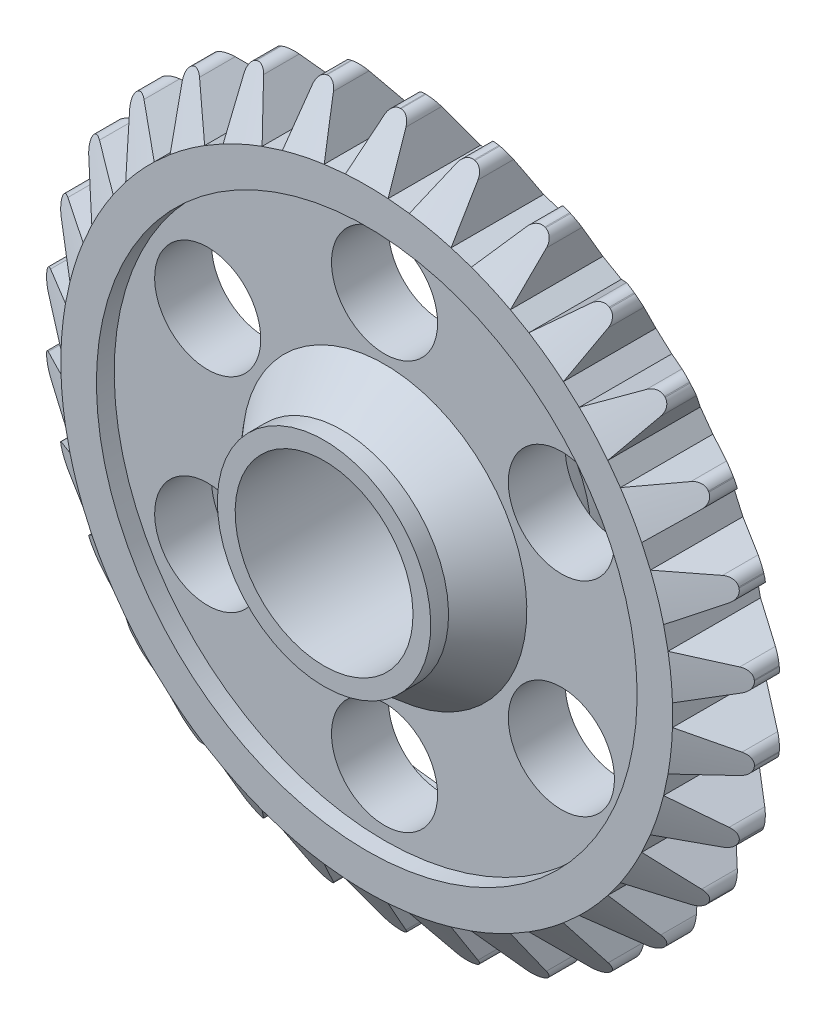
from build123d import *

# Parameters (mm, degrees)
SKETCH_4_W                           = 24
SKETCH_4_H                           = 6
CUT_REVOLVE_1_ANGLE                  = 180
SKETCH_6_W                           = 50
SKETCH_6_H                           = 25
SKETCH_10_W                          = 25
SKETCH_10_H                          = 15
REVOLVE_3_ANGLE                      = 180
SKETCH_13_W                          = 20
SKETCH_13_H                          = 26
CUT_REVOLVE_4_ANGLE                  = 20
PATTERN_CIRCULAR_30_COUNT            = 30
PATTERN_CIRCULAR_30_COPY_1_SKETCH_W  = 20
PATTERN_CIRCULAR_30_COPY_1_SKETCH_H  = 26
PATTERN_CIRCULAR_30_COPY_1_ANGLE     = 20
PATTERN_CIRCULAR_30_COPY_2_SKETCH_W  = 20
PATTERN_CIRCULAR_30_COPY_2_SKETCH_H  = 26
PATTERN_CIRCULAR_30_COPY_2_ANGLE     = 20
PATTERN_CIRCULAR_30_COPY_3_SKETCH_W  = 20
PATTERN_CIRCULAR_30_COPY_3_SKETCH_H  = 26
PATTERN_CIRCULAR_30_COPY_3_ANGLE     = 20
PATTERN_CIRCULAR_30_COPY_4_SKETCH_W  = 20
PATTERN_CIRCULAR_30_COPY_4_SKETCH_H  = 26
PATTERN_CIRCULAR_30_COPY_4_ANGLE     = 20
PATTERN_CIRCULAR_30_COPY_5_SKETCH_W  = 20
PATTERN_CIRCULAR_30_COPY_5_SKETCH_H  = 26
PATTERN_CIRCULAR_30_COPY_5_ANGLE     = 20
PATTERN_CIRCULAR_30_COPY_6_SKETCH_W  = 20
PATTERN_CIRCULAR_30_COPY_6_SKETCH_H  = 26
PATTERN_CIRCULAR_30_COPY_6_ANGLE     = 20
PATTERN_CIRCULAR_30_COPY_7_SKETCH_W  = 20
PATTERN_CIRCULAR_30_COPY_7_SKETCH_H  = 26
PATTERN_CIRCULAR_30_COPY_7_ANGLE     = 20
PATTERN_CIRCULAR_30_COPY_8_SKETCH_W  = 20
PATTERN_CIRCULAR_30_COPY_8_SKETCH_H  = 26
PATTERN_CIRCULAR_30_COPY_8_ANGLE     = 20
PATTERN_CIRCULAR_30_COPY_9_SKETCH_W  = 20
PATTERN_CIRCULAR_30_COPY_9_SKETCH_H  = 26
PATTERN_CIRCULAR_30_COPY_9_ANGLE     = 20
PATTERN_CIRCULAR_30_COPY_10_SKETCH_W = 20
PATTERN_CIRCULAR_30_COPY_10_SKETCH_H = 26
PATTERN_CIRCULAR_30_COPY_10_ANGLE    = 20
PATTERN_CIRCULAR_30_COPY_11_SKETCH_W = 20
PATTERN_CIRCULAR_30_COPY_11_SKETCH_H = 26
PATTERN_CIRCULAR_30_COPY_11_ANGLE    = 20
PATTERN_CIRCULAR_30_COPY_12_SKETCH_W = 20
PATTERN_CIRCULAR_30_COPY_12_SKETCH_H = 26
PATTERN_CIRCULAR_30_COPY_12_ANGLE    = 20
PATTERN_CIRCULAR_30_COPY_13_SKETCH_W = 20
PATTERN_CIRCULAR_30_COPY_13_SKETCH_H = 26
PATTERN_CIRCULAR_30_COPY_13_ANGLE    = 20
PATTERN_CIRCULAR_30_COPY_14_SKETCH_W = 20
PATTERN_CIRCULAR_30_COPY_14_SKETCH_H = 26
PATTERN_CIRCULAR_30_COPY_14_ANGLE    = 20
PATTERN_CIRCULAR_30_COPY_15_SKETCH_W = 20
PATTERN_CIRCULAR_30_COPY_15_SKETCH_H = 26
PATTERN_CIRCULAR_30_COPY_15_ANGLE    = 20
PATTERN_CIRCULAR_30_COPY_16_SKETCH_W = 20
PATTERN_CIRCULAR_30_COPY_16_SKETCH_H = 26
PATTERN_CIRCULAR_30_COPY_16_ANGLE    = 20
PATTERN_CIRCULAR_30_COPY_17_SKETCH_W = 20
PATTERN_CIRCULAR_30_COPY_17_SKETCH_H = 26
PATTERN_CIRCULAR_30_COPY_17_ANGLE    = 20
PATTERN_CIRCULAR_30_COPY_18_SKETCH_W = 20
PATTERN_CIRCULAR_30_COPY_18_SKETCH_H = 26
PATTERN_CIRCULAR_30_COPY_18_ANGLE    = 20
PATTERN_CIRCULAR_30_COPY_19_SKETCH_W = 20
PATTERN_CIRCULAR_30_COPY_19_SKETCH_H = 26
PATTERN_CIRCULAR_30_COPY_19_ANGLE    = 20
PATTERN_CIRCULAR_30_COPY_20_SKETCH_W = 20
PATTERN_CIRCULAR_30_COPY_20_SKETCH_H = 26
PATTERN_CIRCULAR_30_COPY_20_ANGLE    = 20
PATTERN_CIRCULAR_30_COPY_21_SKETCH_W = 20
PATTERN_CIRCULAR_30_COPY_21_SKETCH_H = 26
PATTERN_CIRCULAR_30_COPY_21_ANGLE    = 20
PATTERN_CIRCULAR_30_COPY_22_SKETCH_W = 20
PATTERN_CIRCULAR_30_COPY_22_SKETCH_H = 26
PATTERN_CIRCULAR_30_COPY_22_ANGLE    = 20
PATTERN_CIRCULAR_30_COPY_23_SKETCH_W = 20
PATTERN_CIRCULAR_30_COPY_23_SKETCH_H = 26
PATTERN_CIRCULAR_30_COPY_23_ANGLE    = 20
PATTERN_CIRCULAR_30_COPY_24_SKETCH_W = 20
PATTERN_CIRCULAR_30_COPY_24_SKETCH_H = 26
PATTERN_CIRCULAR_30_COPY_24_ANGLE    = 20
PATTERN_CIRCULAR_30_COPY_25_SKETCH_W = 20
PATTERN_CIRCULAR_30_COPY_25_SKETCH_H = 26
PATTERN_CIRCULAR_30_COPY_25_ANGLE    = 20
PATTERN_CIRCULAR_30_COPY_26_SKETCH_W = 20
PATTERN_CIRCULAR_30_COPY_26_SKETCH_H = 26
PATTERN_CIRCULAR_30_COPY_26_ANGLE    = 20
PATTERN_CIRCULAR_30_COPY_27_SKETCH_W = 20
PATTERN_CIRCULAR_30_COPY_27_SKETCH_H = 26
PATTERN_CIRCULAR_30_COPY_27_ANGLE    = 20
PATTERN_CIRCULAR_30_COPY_28_SKETCH_W = 20
PATTERN_CIRCULAR_30_COPY_28_SKETCH_H = 26
PATTERN_CIRCULAR_30_COPY_28_ANGLE    = 20
PATTERN_CIRCULAR_30_COPY_29_SKETCH_W = 20
PATTERN_CIRCULAR_30_COPY_29_SKETCH_H = 26
PATTERN_CIRCULAR_30_COPY_29_ANGLE    = 20
FILLET_7_R                           = 3
SKETCH_15_W                          = 26
SKETCH_15_H                          = 14.918348738
PATTERN_CIRCULAR_31_COUNT            = 6


with BuildPart() as part:
    # Эскиз2 → Повернуть1 (revolve)
    with BuildSketch(Plane(origin=(0, 0, 0), x_dir=(0, 0, -1), z_dir=(1, 0, 0)), mode=Mode.PRIVATE) as revolve_1_sk:
        Polygon((-20, 0), (20, 0), (20, 25), (25, 25), (25, 30), (20, 30), (8, 40), (8, 76), (13, 76), (13, 86), (3.5, 100), (-3.5, 100), (-13, 86), (-13, 76), (-8, 76), (-8, 40), (-20, 30), (-25, 30), (-25, 25), (-20, 25), align=None)
    revolve(revolve_1_sk.sketch.rotate(Axis((0, 0, 20), (0, 0, -1)), 180), axis=Axis((0, 0, 20), (0, 0, -1)))

    # Эскиз4 → Вырез-Повернуть1 (revolve, symmetric, cut)
    with BuildSketch(Plane.XY) as cut_revolve_1_sk:
        with Locations((-97.947658491, 0)):
            Rectangle(SKETCH_4_W, SKETCH_4_H)
    cut_revolve_1 = revolve(axis=Axis((-85.947658491, 3, 0), (0, -1, 0)), revolution_arc=CUT_REVOLVE_1_ANGLE / 2, mode=Mode.SUBTRACT)
    cut_revolve_1 = cut_revolve_1 + revolve(cut_revolve_1_sk.sketch, axis=Axis((-85.947658491, 3, 0), (0, 1, 0)), revolution_arc=CUT_REVOLVE_1_ANGLE / 2, mode=Mode.SUBTRACT)

    # Эскиз6 → Вырез-Повернуть2 (revolve, cut)
    with BuildSketch(Plane(origin=(0, 0, 0), x_dir=(0, 0, -1), z_dir=(1, 0, 0)), mode=Mode.PRIVATE) as cut_revolve_2_sk:
        with Locations((0, 12.5)):
            Rectangle(SKETCH_6_W, SKETCH_6_H)
    revolve(cut_revolve_2_sk.sketch.rotate(Axis((0, 0, 25), (0, 0, -1)), 180), axis=Axis((0, 0, 25), (0, 0, -1)), mode=Mode.SUBTRACT)

    # Эскиз10 → Повернуть3 (revolve)
    with BuildSketch(Plane(origin=(0, 10, 0), x_dir=(-1, 0, 0), z_dir=(0, -1, 0))):
        with Locations((12.5, 0)):
            Rectangle(SKETCH_10_W, SKETCH_10_H)
    revolve(axis=Axis((0, 10, 7.5), (0, 0, -1)), revolution_arc=REVOLVE_3_ANGLE)

    # Эскиз13 → Вырез-Повернуть4 (revolve, cut)
    with BuildSketch(Plane(origin=(0, 3, 0), x_dir=(1, 0, 0), z_dir=(0, 1, 0))):
        with Locations((-95.947658491, 0)):
            Rectangle(SKETCH_13_W, SKETCH_13_H)
    cut_revolve_4 = revolve(axis=Axis((-85.947658491, 3, -13), (0, 0, -1)), revolution_arc=CUT_REVOLVE_4_ANGLE, mode=Mode.SUBTRACT)

    # Зеркальное отражение1: Вырез-Повернуть4 across plane
    add(cut_revolve_4.mirror(Plane.ZX), mode=Mode.SUBTRACT)

    # Круговой массив30: Вырез-Повернуть1, Вырез-Повернуть4 ×30 about axis
    pattern_circular_30_axis = Axis((0, 0, 0), (0, 0, 1))
    add([cut_revolve_1.rotate(pattern_circular_30_axis, i * 360 / PATTERN_CIRCULAR_30_COUNT) for i in range(1, PATTERN_CIRCULAR_30_COUNT)], mode=Mode.SUBTRACT)
    add([cut_revolve_4.rotate(pattern_circular_30_axis, i * 360 / PATTERN_CIRCULAR_30_COUNT) for i in range(1, PATTERN_CIRCULAR_30_COUNT)], mode=Mode.SUBTRACT)

    # Круговой массив30 copy 1 sketch → Круговой массив30 copy 1 (revolve, cut)
    with BuildSketch(Plane(origin=(0.623735072, -2.934442802, 0), x_dir=(0.9781476007338057, 0.20791169081775934, 0), z_dir=(0.20791169081775934, -0.9781476007338057, 0))):
        with Locations((-95.947658491, 0)):
            Rectangle(PATTERN_CIRCULAR_30_COPY_1_SKETCH_W, PATTERN_CIRCULAR_30_COPY_1_SKETCH_H)
    revolve(axis=Axis((-83.445760869, -20.803965801, -13), (0, 0, 1)), revolution_arc=PATTERN_CIRCULAR_30_COPY_1_ANGLE, mode=Mode.SUBTRACT)

    # Круговой массив30 copy 2 sketch → Круговой массив30 copy 2 (revolve, cut)
    with BuildSketch(Plane(origin=(1.220209929, -2.740636373, 0), x_dir=(0.9135454576426009, 0.4067366430758002, 0), z_dir=(0.4067366430758002, -0.9135454576426009, 0))):
        with Locations((-95.947658491, 0)):
            Rectangle(PATTERN_CIRCULAR_30_COPY_2_SKETCH_W, PATTERN_CIRCULAR_30_COPY_2_SKETCH_H)
    revolve(axis=Axis((-77.29688308, -37.698698468, -13), (0, 0, 1)), revolution_arc=PATTERN_CIRCULAR_30_COPY_2_ANGLE, mode=Mode.SUBTRACT)

    # Круговой массив30 copy 3 sketch → Круговой массив30 copy 3 (revolve, cut)
    with BuildSketch(Plane(origin=(1.763355757, -2.427050983, 0), x_dir=(0.8090169943749475, 0.5877852522924731, 0), z_dir=(0.5877852522924731, -0.8090169943749475, 0))):
        with Locations((-95.947658491, 0)):
            Rectangle(PATTERN_CIRCULAR_30_COPY_3_SKETCH_W, PATTERN_CIRCULAR_30_COPY_3_SKETCH_H)
    revolve(axis=Axis((-67.769760589, -52.945817113, -13), (0, 0, 1)), revolution_arc=PATTERN_CIRCULAR_30_COPY_3_ANGLE, mode=Mode.SUBTRACT)

    # Круговой массив30 copy 4 sketch → Круговой массив30 copy 4 (revolve, cut)
    with BuildSketch(Plane(origin=(2.229434476, -2.007391819, 0), x_dir=(0.6691306063588582, 0.7431448254773942, 0), z_dir=(0.7431448254773942, -0.6691306063588582, 0))):
        with Locations((-95.947658491, 0)):
            Rectangle(PATTERN_CIRCULAR_30_COPY_4_SKETCH_W, PATTERN_CIRCULAR_30_COPY_4_SKETCH_H)
    revolve(axis=Axis((-55.280774364, -65.878949488, -13), (0, 0, 1)), revolution_arc=PATTERN_CIRCULAR_30_COPY_4_ANGLE, mode=Mode.SUBTRACT)

    # Круговой массив30 copy 5 sketch → Круговой массив30 copy 5 (revolve, cut)
    with BuildSketch(Plane(origin=(2.598076211, -1.5, 0), x_dir=(0.5000000000000001, 0.8660254037844386, 0), z_dir=(0.8660254037844386, -0.5000000000000001, 0))):
        with Locations((-95.947658491, 0)):
            Rectangle(PATTERN_CIRCULAR_30_COPY_5_SKETCH_W, PATTERN_CIRCULAR_30_COPY_5_SKETCH_H)
    revolve(axis=Axis((-40.375753034, -75.932855649, -13), (0, 0, 1)), revolution_arc=PATTERN_CIRCULAR_30_COPY_5_ANGLE, mode=Mode.SUBTRACT)

    # Круговой массив30 copy 6 sketch → Круговой массив30 copy 6 (revolve, cut)
    with BuildSketch(Plane(origin=(2.853169549, -0.927050983, 0), x_dir=(0.30901699437494745, 0.9510565162951535, 0), z_dir=(0.9510565162951535, -0.30901699437494745, 0))):
        with Locations((-95.947658491, 0)):
            Rectangle(PATTERN_CIRCULAR_30_COPY_6_SKETCH_W, PATTERN_CIRCULAR_30_COPY_6_SKETCH_H)
    revolve(axis=Axis((-23.706117551, -82.668131651, -13), (0, 0, 1)), revolution_arc=PATTERN_CIRCULAR_30_COPY_6_ANGLE, mode=Mode.SUBTRACT)

    # Круговой массив30 copy 7 sketch → Круговой массив30 copy 7 (revolve, cut)
    with BuildSketch(Plane(origin=(2.983565686, -0.31358539, 0), x_dir=(0.10452846326765346, 0.9945218953682733, 0), z_dir=(0.9945218953682733, -0.10452846326765346, 0))):
        with Locations((-95.947658491, 0)):
            Rectangle(PATTERN_CIRCULAR_30_COPY_7_SKETCH_W, PATTERN_CIRCULAR_30_COPY_7_SKETCH_H)
    revolve(axis=Axis((-6.000410977, -85.790413614, -13), (0, 0, 1)), revolution_arc=PATTERN_CIRCULAR_30_COPY_7_ANGLE, mode=Mode.SUBTRACT)

    # Круговой массив30 copy 8 sketch → Круговой массив30 copy 8 (revolve, cut)
    with BuildSketch(Plane(origin=(2.983565686, 0.31358539, 0), x_dir=(-0.10452846326765355, 0.9945218953682733, 0), z_dir=(0.9945218953682733, 0.10452846326765355, 0))):
        with Locations((-95.947658491, 0)):
            Rectangle(PATTERN_CIRCULAR_30_COPY_8_SKETCH_W, PATTERN_CIRCULAR_30_COPY_8_SKETCH_H)
    revolve(axis=Axis((11.96754235, -85.163242835, -13), (0, 0, 1)), revolution_arc=PATTERN_CIRCULAR_30_COPY_8_ANGLE, mode=Mode.SUBTRACT)

    # Круговой массив30 copy 9 sketch → Круговой массив30 copy 9 (revolve, cut)
    with BuildSketch(Plane(origin=(2.853169549, 0.927050983, 0), x_dir=(-0.30901699437494734, 0.9510565162951536, 0), z_dir=(0.9510565162951536, 0.30901699437494734, 0))):
        with Locations((-95.947658491, 0)):
            Rectangle(PATTERN_CIRCULAR_30_COPY_9_SKETCH_W, PATTERN_CIRCULAR_30_COPY_9_SKETCH_H)
    revolve(axis=Axis((29.412456649, -80.814029685, -13), (0, 0, 1)), revolution_arc=PATTERN_CIRCULAR_30_COPY_9_ANGLE, mode=Mode.SUBTRACT)

    # Круговой массив30 copy 10 sketch → Круговой массив30 copy 10 (revolve, cut)
    with BuildSketch(Plane(origin=(2.598076211, 1.5, 0), x_dir=(-0.4999999999999998, 0.8660254037844387, 0), z_dir=(0.8660254037844387, 0.4999999999999998, 0))):
        with Locations((-95.947658491, 0)):
            Rectangle(PATTERN_CIRCULAR_30_COPY_10_SKETCH_W, PATTERN_CIRCULAR_30_COPY_10_SKETCH_H)
    revolve(axis=Axis((45.571905457, -72.932855649, -13), (0, 0, 1)), revolution_arc=PATTERN_CIRCULAR_30_COPY_10_ANGLE, mode=Mode.SUBTRACT)

    # Круговой массив30 copy 11 sketch → Круговой массив30 copy 11 (revolve, cut)
    with BuildSketch(Plane(origin=(2.229434476, 2.007391819, 0), x_dir=(-0.6691306063588582, 0.7431448254773942, 0), z_dir=(0.7431448254773942, 0.6691306063588582, 0))):
        with Locations((-95.947658491, 0)):
            Rectangle(PATTERN_CIRCULAR_30_COPY_11_SKETCH_W, PATTERN_CIRCULAR_30_COPY_11_SKETCH_H)
    revolve(axis=Axis((59.739643317, -61.86416585, -13), (0, 0, 1)), revolution_arc=PATTERN_CIRCULAR_30_COPY_11_ANGLE, mode=Mode.SUBTRACT)

    # Круговой массив30 copy 12 sketch → Круговой массив30 copy 12 (revolve, cut)
    with BuildSketch(Plane(origin=(1.763355757, 2.427050983, 0), x_dir=(-0.8090169943749473, 0.5877852522924732, 0), z_dir=(0.5877852522924732, 0.8090169943749473, 0))):
        with Locations((-95.947658491, 0)):
            Rectangle(PATTERN_CIRCULAR_30_COPY_12_SKETCH_W, PATTERN_CIRCULAR_30_COPY_12_SKETCH_H)
    revolve(axis=Axis((71.296472102, -48.091715147, -13), (0, 0, 1)), revolution_arc=PATTERN_CIRCULAR_30_COPY_12_ANGLE, mode=Mode.SUBTRACT)

    # Круговой массив30 copy 13 sketch → Круговой массив30 copy 13 (revolve, cut)
    with BuildSketch(Plane(origin=(1.220209929, 2.740636373, 0), x_dir=(-0.9135454576426008, 0.40673664307580043, 0), z_dir=(0.40673664307580043, 0.9135454576426008, 0))):
        with Locations((-95.947658491, 0)):
            Rectangle(PATTERN_CIRCULAR_30_COPY_13_SKETCH_W, PATTERN_CIRCULAR_30_COPY_13_SKETCH_H)
    revolve(axis=Axis((79.737302938, -32.217425722, -13), (0, 0, 1)), revolution_arc=PATTERN_CIRCULAR_30_COPY_13_ANGLE, mode=Mode.SUBTRACT)

    # Круговой массив30 copy 14 sketch → Круговой массив30 copy 14 (revolve, cut)
    with BuildSketch(Plane(origin=(0.623735072, 2.934442802, 0), x_dir=(-0.9781476007338057, 0.20791169081775931, 0), z_dir=(0.20791169081775931, 0.9781476007338057, 0))):
        with Locations((-95.947658491, 0)):
            Rectangle(PATTERN_CIRCULAR_30_COPY_14_SKETCH_W, PATTERN_CIRCULAR_30_COPY_14_SKETCH_H)
    revolve(axis=Axis((84.693231014, -14.935080196, -13), (0, 0, 1)), revolution_arc=PATTERN_CIRCULAR_30_COPY_14_ANGLE, mode=Mode.SUBTRACT)

    # Круговой массив30 copy 15 sketch → Круговой массив30 copy 15 (revolve, cut)
    with BuildSketch(Plane(origin=(0, 3, 0), x_dir=(-1, 0, 0), z_dir=(0, 1, 0))):
        with Locations((-95.947658491, 0)):
            Rectangle(PATTERN_CIRCULAR_30_COPY_15_SKETCH_W, PATTERN_CIRCULAR_30_COPY_15_SKETCH_H)
    revolve(axis=Axis((85.947658491, 3, -13), (0, 0, 1)), revolution_arc=PATTERN_CIRCULAR_30_COPY_15_ANGLE, mode=Mode.SUBTRACT)

    # Круговой массив30 copy 16 sketch → Круговой массив30 copy 16 (revolve, cut)
    with BuildSketch(Plane(origin=(-0.623735072, 2.934442802, 0), x_dir=(-0.9781476007338056, -0.2079116908177595, 0), z_dir=(-0.2079116908177595, 0.9781476007338056, 0))):
        with Locations((-95.947658491, 0)):
            Rectangle(PATTERN_CIRCULAR_30_COPY_16_SKETCH_W, PATTERN_CIRCULAR_30_COPY_16_SKETCH_H)
    revolve(axis=Axis((83.445760869, 20.803965801, -13), (0, 0, 1)), revolution_arc=PATTERN_CIRCULAR_30_COPY_16_ANGLE, mode=Mode.SUBTRACT)

    # Круговой массив30 copy 17 sketch → Круговой массив30 copy 17 (revolve, cut)
    with BuildSketch(Plane(origin=(-1.220209929, 2.740636373, 0), x_dir=(-0.9135454576426009, -0.4067366430758002, 0), z_dir=(-0.4067366430758002, 0.9135454576426009, 0))):
        with Locations((-95.947658491, 0)):
            Rectangle(PATTERN_CIRCULAR_30_COPY_17_SKETCH_W, PATTERN_CIRCULAR_30_COPY_17_SKETCH_H)
    revolve(axis=Axis((77.29688308, 37.698698468, -13), (0, 0, 1)), revolution_arc=PATTERN_CIRCULAR_30_COPY_17_ANGLE, mode=Mode.SUBTRACT)

    # Круговой массив30 copy 18 sketch → Круговой массив30 copy 18 (revolve, cut)
    with BuildSketch(Plane(origin=(-1.763355757, 2.427050983, 0), x_dir=(-0.8090169943749476, -0.587785252292473, 0), z_dir=(-0.587785252292473, 0.8090169943749476, 0))):
        with Locations((-95.947658491, 0)):
            Rectangle(PATTERN_CIRCULAR_30_COPY_18_SKETCH_W, PATTERN_CIRCULAR_30_COPY_18_SKETCH_H)
    revolve(axis=Axis((67.769760589, 52.945817113, -13), (0, 0, 1)), revolution_arc=PATTERN_CIRCULAR_30_COPY_18_ANGLE, mode=Mode.SUBTRACT)

    # Круговой массив30 copy 19 sketch → Круговой массив30 copy 19 (revolve, cut)
    with BuildSketch(Plane(origin=(-2.229434476, 2.007391819, 0), x_dir=(-0.6691306063588581, -0.7431448254773944, 0), z_dir=(-0.7431448254773944, 0.6691306063588581, 0))):
        with Locations((-95.947658491, 0)):
            Rectangle(PATTERN_CIRCULAR_30_COPY_19_SKETCH_W, PATTERN_CIRCULAR_30_COPY_19_SKETCH_H)
    revolve(axis=Axis((55.280774364, 65.878949488, -13), (0, 0, 1)), revolution_arc=PATTERN_CIRCULAR_30_COPY_19_ANGLE, mode=Mode.SUBTRACT)

    # Круговой массив30 copy 20 sketch → Круговой массив30 copy 20 (revolve, cut)
    with BuildSketch(Plane(origin=(-2.598076211, 1.5, 0), x_dir=(-0.5000000000000004, -0.8660254037844384, 0), z_dir=(-0.8660254037844384, 0.5000000000000004, 0))):
        with Locations((-95.947658491, 0)):
            Rectangle(PATTERN_CIRCULAR_30_COPY_20_SKETCH_W, PATTERN_CIRCULAR_30_COPY_20_SKETCH_H)
    revolve(axis=Axis((40.375753034, 75.932855649, -13), (0, 0, 1)), revolution_arc=PATTERN_CIRCULAR_30_COPY_20_ANGLE, mode=Mode.SUBTRACT)

    # Круговой массив30 copy 21 sketch → Круговой массив30 copy 21 (revolve, cut)
    with BuildSketch(Plane(origin=(-2.853169549, 0.927050983, 0), x_dir=(-0.30901699437494756, -0.9510565162951535, 0), z_dir=(-0.9510565162951535, 0.30901699437494756, 0))):
        with Locations((-95.947658491, 0)):
            Rectangle(PATTERN_CIRCULAR_30_COPY_21_SKETCH_W, PATTERN_CIRCULAR_30_COPY_21_SKETCH_H)
    revolve(axis=Axis((23.706117551, 82.668131651, -13), (0, 0, 1)), revolution_arc=PATTERN_CIRCULAR_30_COPY_21_ANGLE, mode=Mode.SUBTRACT)

    # Круговой массив30 copy 22 sketch → Круговой массив30 copy 22 (revolve, cut)
    with BuildSketch(Plane(origin=(-2.983565686, 0.31358539, 0), x_dir=(-0.10452846326765336, -0.9945218953682734, 0), z_dir=(-0.9945218953682734, 0.10452846326765336, 0))):
        with Locations((-95.947658491, 0)):
            Rectangle(PATTERN_CIRCULAR_30_COPY_22_SKETCH_W, PATTERN_CIRCULAR_30_COPY_22_SKETCH_H)
    revolve(axis=Axis((6.000410977, 85.790413614, -13), (0, 0, 1)), revolution_arc=PATTERN_CIRCULAR_30_COPY_22_ANGLE, mode=Mode.SUBTRACT)

    # Круговой массив30 copy 23 sketch → Круговой массив30 copy 23 (revolve, cut)
    with BuildSketch(Plane(origin=(-2.983565686, -0.31358539, 0), x_dir=(0.10452846326765299, -0.9945218953682734, 0), z_dir=(-0.9945218953682734, -0.10452846326765299, 0))):
        with Locations((-95.947658491, 0)):
            Rectangle(PATTERN_CIRCULAR_30_COPY_23_SKETCH_W, PATTERN_CIRCULAR_30_COPY_23_SKETCH_H)
    revolve(axis=Axis((-11.96754235, 85.163242835, -13), (0, 0, 1)), revolution_arc=PATTERN_CIRCULAR_30_COPY_23_ANGLE, mode=Mode.SUBTRACT)

    # Круговой массив30 copy 24 sketch → Круговой массив30 copy 24 (revolve, cut)
    with BuildSketch(Plane(origin=(-2.853169549, -0.927050983, 0), x_dir=(0.30901699437494723, -0.9510565162951536, 0), z_dir=(-0.9510565162951536, -0.30901699437494723, 0))):
        with Locations((-95.947658491, 0)):
            Rectangle(PATTERN_CIRCULAR_30_COPY_24_SKETCH_W, PATTERN_CIRCULAR_30_COPY_24_SKETCH_H)
    revolve(axis=Axis((-29.412456649, 80.814029685, -13), (0, 0, 1)), revolution_arc=PATTERN_CIRCULAR_30_COPY_24_ANGLE, mode=Mode.SUBTRACT)

    # Круговой массив30 copy 25 sketch → Круговой массив30 copy 25 (revolve, cut)
    with BuildSketch(Plane(origin=(-2.598076211, -1.5, 0), x_dir=(0.5000000000000001, -0.8660254037844386, 0), z_dir=(-0.8660254037844386, -0.5000000000000001, 0))):
        with Locations((-95.947658491, 0)):
            Rectangle(PATTERN_CIRCULAR_30_COPY_25_SKETCH_W, PATTERN_CIRCULAR_30_COPY_25_SKETCH_H)
    revolve(axis=Axis((-45.571905457, 72.932855649, -13), (0, 0, 1)), revolution_arc=PATTERN_CIRCULAR_30_COPY_25_ANGLE, mode=Mode.SUBTRACT)

    # Круговой массив30 copy 26 sketch → Круговой массив30 copy 26 (revolve, cut)
    with BuildSketch(Plane(origin=(-2.229434476, -2.007391819, 0), x_dir=(0.6691306063588578, -0.7431448254773946, 0), z_dir=(-0.7431448254773946, -0.6691306063588578, 0))):
        with Locations((-95.947658491, 0)):
            Rectangle(PATTERN_CIRCULAR_30_COPY_26_SKETCH_W, PATTERN_CIRCULAR_30_COPY_26_SKETCH_H)
    revolve(axis=Axis((-59.739643317, 61.86416585, -13), (0, 0, 1)), revolution_arc=PATTERN_CIRCULAR_30_COPY_26_ANGLE, mode=Mode.SUBTRACT)

    # Круговой массив30 copy 27 sketch → Круговой массив30 copy 27 (revolve, cut)
    with BuildSketch(Plane(origin=(-1.763355757, -2.427050983, 0), x_dir=(0.8090169943749473, -0.5877852522924734, 0), z_dir=(-0.5877852522924734, -0.8090169943749473, 0))):
        with Locations((-95.947658491, 0)):
            Rectangle(PATTERN_CIRCULAR_30_COPY_27_SKETCH_W, PATTERN_CIRCULAR_30_COPY_27_SKETCH_H)
    revolve(axis=Axis((-71.296472102, 48.091715147, -13), (0, 0, 1)), revolution_arc=PATTERN_CIRCULAR_30_COPY_27_ANGLE, mode=Mode.SUBTRACT)

    # Круговой массив30 copy 28 sketch → Круговой массив30 copy 28 (revolve, cut)
    with BuildSketch(Plane(origin=(-1.220209929, -2.740636373, 0), x_dir=(0.913545457642601, -0.40673664307580015, 0), z_dir=(-0.40673664307580015, -0.913545457642601, 0))):
        with Locations((-95.947658491, 0)):
            Rectangle(PATTERN_CIRCULAR_30_COPY_28_SKETCH_W, PATTERN_CIRCULAR_30_COPY_28_SKETCH_H)
    revolve(axis=Axis((-79.737302938, 32.217425722, -13), (0, 0, 1)), revolution_arc=PATTERN_CIRCULAR_30_COPY_28_ANGLE, mode=Mode.SUBTRACT)

    # Круговой массив30 copy 29 sketch → Круговой массив30 copy 29 (revolve, cut)
    with BuildSketch(Plane(origin=(-0.623735072, -2.934442802, 0), x_dir=(0.9781476007338056, -0.20791169081775987, 0), z_dir=(-0.20791169081775987, -0.9781476007338056, 0))):
        with Locations((-95.947658491, 0)):
            Rectangle(PATTERN_CIRCULAR_30_COPY_29_SKETCH_W, PATTERN_CIRCULAR_30_COPY_29_SKETCH_H)
    revolve(axis=Axis((-84.693231014, 14.935080196, -13), (0, 0, 1)), revolution_arc=PATTERN_CIRCULAR_30_COPY_29_ANGLE, mode=Mode.SUBTRACT)

    # Скругление7
    fillet_7_edges = [part.edges().sort_by_distance(p)[0] for p in [
        (-38.409286404, 92.329446646, 0),
        (-42.913321413, 90.32412106, 0),
        (-56.766322707, 82.326087034, 0),
        (-60.755003111, 79.42814109, 0),
        (-72.642398312, 68.724682375, 0),
        (-75.941399638, 65.060770216, 0),
        (-85.343652534, 52.119679318, 0),
        (-87.808792593, 47.849931487, 0),
        (-94.314979615, 33.236796177, 0),
        (-95.83851996, 28.547821142, 0),
        (-99.164289515, 12.901305556, 0),
        (-99.679644119, 7.998034026, 0),
        (-99.679644119, -7.998034026, 0),
        (-99.164289515, -12.901305556, 0),
        (-95.83851996, -28.547821142, 0),
        (-94.314979615, -33.236796177, 0),
        (-87.808792593, -47.849931487, 0),
        (-85.343652534, -52.119679318, 0),
        (-72.642398312, -68.724682375, 0),
        (-75.941399638, -65.060770216, 0),
        (-56.766322707, -82.326087034, 0),
        (-60.755003111, -79.42814109, 0),
        (-38.409286404, -92.329446646, 0),
        (-42.913321413, -90.32412106, 0),
        (-18.373579978, -98.297566393, 0),
        (-23.196121648, -97.272503517, 0),
        (-2.46514006, -99.969610805, 0),
        (2.46514006, -99.969610805, 0),
        (42.913321413, -90.32412106, 0),
        (38.409286404, -92.329446646, 0),
        (23.196121648, -97.272503517, 0),
        (18.373579978, -98.297566393, 0),
        (60.755003111, -79.42814109, 0),
        (56.766322707, -82.326087034, 0),
        (75.941399638, -65.060770216, 0),
        (72.642398312, -68.724682375, 0),
        (87.808792593, -47.849931487, 0),
        (85.343652534, -52.119679318, 0),
        (95.83851996, -28.547821142, 0),
        (94.314979615, -33.236796177, 0),
        (99.679644119, -7.998034026, 0),
        (99.164289515, -12.901305556, 0),
        (99.679644119, 7.998034026, 0),
        (99.164289515, 12.901305556, 0),
        (95.83851996, 28.547821142, 0),
        (94.314979615, 33.236796177, 0),
        (87.808792593, 47.849931487, 0),
        (85.343652534, 52.119679318, 0),
        (75.941399638, 65.060770216, 0),
        (72.642398312, 68.724682375, 0),
        (60.755003111, 79.42814109, 0),
        (56.766322707, 82.326087034, 0),
        (38.409286404, 92.329446646, 0),
        (42.913321413, 90.32412106, 0),
        (2.46514006, 99.969610805, 0),
        (-2.46514006, 99.969610805, 0),
        (-23.196121648, 97.272503517, 0),
        (-18.373579978, 98.297566393, 0),
        (18.373579978, 98.297566393, 0),
        (23.196121648, 97.272503517, 0),
    ]]
    fillet(fillet_7_edges, radius=FILLET_7_R)

    # Эскиз15 → Вырез-Повернуть6 (revolve, cut)
    with BuildSketch(Plane(origin=(0, 0, 0), x_dir=(0, 0, -1), z_dir=(1, 0, 0)), mode=Mode.PRIVATE) as cut_revolve_6_sk:
        with Locations((0, 64.86416585)):
            Rectangle(SKETCH_15_W, SKETCH_15_H)
    cut_revolve_6 = revolve(cut_revolve_6_sk.sketch.rotate(Axis((0, 57.404991481, 13), (0, 0, -1)), 180), axis=Axis((0, 57.404991481, 13), (0, 0, -1)), mode=Mode.SUBTRACT)

    # Круговой массив31: Вырез-Повернуть6 ×6 about axis
    pattern_circular_31_axis = Axis((0, 0, 0), (0, 0, 1))
    for i in range(1, PATTERN_CIRCULAR_31_COUNT):
        add(cut_revolve_6.rotate(pattern_circular_31_axis, i * 360 / PATTERN_CIRCULAR_31_COUNT), mode=Mode.SUBTRACT)


solid = part.part
